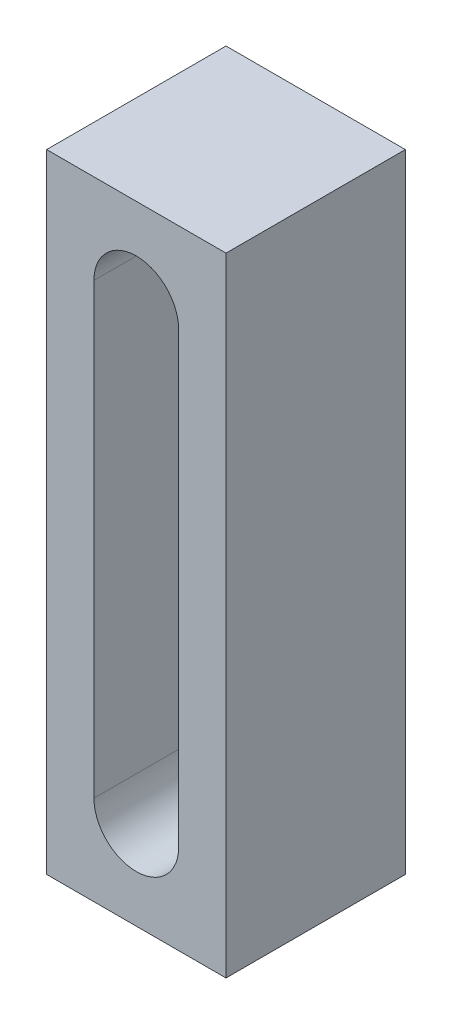
from build123d import *

# Parameters (mm, degrees)
SKETCH1_W           = 6.35
SKETCH1_H           = 22.225
BOSS_EXTRUDE1_DEPTH = 3.175


with BuildPart() as part:
    # Sketch1 → Boss-Extrude1 (new, symmetric)
    with BuildSketch(Plane.XY):
        Rectangle(SKETCH1_W, SKETCH1_H)
        with BuildLine():
            Line((-1.5, -7.9375), (-1.5, 7.9375))
            ThreePointArc((-1.5, 7.9375), (0, 9.4375), (1.5, 7.9375))
            Line((1.5, 7.9375), (1.5, -7.9375))
            ThreePointArc((1.5, -7.9375), (0, -9.4375), (-1.5, -7.9375))
        make_face(mode=Mode.SUBTRACT)
    extrude(amount=BOSS_EXTRUDE1_DEPTH, both=True)


solid = part.part
